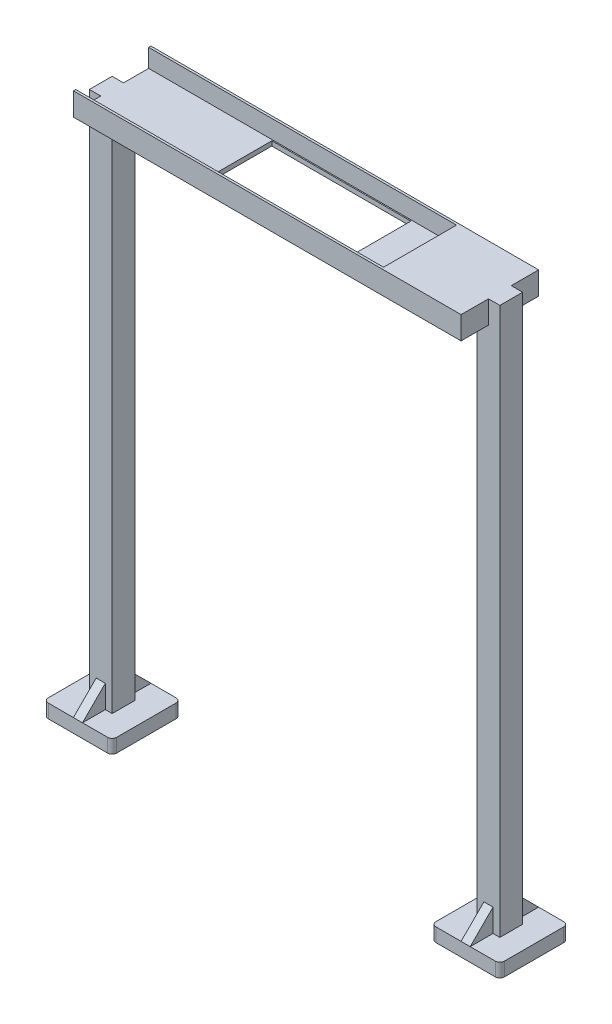
from build123d import *

# Parameters (mm, degrees)
SALIENTE_EXTRUIR1_DEPTH      = 3
SALIENTE_EXTRUIR1_2_DEPTH    = 3
SALIENTE_EXTRUIR2_DEPTH      = 1
SALIENTE_EXTRUIR2_DEPTH_BACK = 1
CROQUIS3_W                   = 5
CROQUIS3_H                   = 5
SALIENTE_EXTRUIR3_DEPTH      = 120
SALIENTE_EXTRUIR4_DEPTH      = 1
SALIENTE_EXTRUIR4_DEPTH_BACK = 1
CROQUIS7_W                   = 5
CROQUIS7_H                   = 5
SALIENTE_EXTRUIR6_DEPTH      = 120
CROQUIS8_W                   = 85
CROQUIS8_H                   = 17
SALIENTE_EXTRUIR7_DEPTH      = 5
CROQUIS9_W                   = 16
CROQUIS9_H                   = 4
CORTAR_EXTRUIR1_DEPTH        = 70
CROQUIS10_W                  = 30.5
CROQUIS10_H                  = 15.5
CORTAR_EXTRUIR2_DEPTH        = 2


with BuildPart() as part:
    # Croquis1 → Saliente-Extruir1 (new body)
    with BuildSketch(Plane(origin=(0, 0, 0), x_dir=(1, 0, 0), z_dir=(0, 1, 0))):
        with BuildLine():
            Line((-6.5, -7.5), (6.5, -7.5))
            ThreePointArc((6.5, -7.5), (7.207106781, -7.207106781), (7.5, -6.5))
            Line((7.5, -6.5), (7.5, 6.5))
            ThreePointArc((7.5, 6.5), (7.207106781, 7.207106781), (6.5, 7.5))
            Line((6.5, 7.5), (-6.5, 7.5))
            ThreePointArc((-6.5, 7.5), (-7.207106781, 7.207106781), (-7.5, 6.5))
            Line((-7.5, 6.5), (-7.5, -6.5))
            ThreePointArc((-7.5, -6.5), (-7.207106781, -7.207106781), (-6.5, -7.5))
        make_face()
    extrude(amount=SALIENTE_EXTRUIR1_DEPTH)

    # Croquis2 → Saliente-Extruir2 (add, two sides: drawn at the far end of the back side and taken through both)
    with BuildSketch(Plane(origin=(0, 0, 0), x_dir=(0, 0, -1), z_dir=(1, 0, 0)).offset(-SALIENTE_EXTRUIR2_DEPTH_BACK)):
        Polygon((-7.5, 3), (-2.5, 8), (-2.5, 3), align=None)
        Polygon((2.5, 3), (7.5, 3), (2.5, 8), align=None)
    extrude(amount=SALIENTE_EXTRUIR2_DEPTH + SALIENTE_EXTRUIR2_DEPTH_BACK)

    # Croquis3 → Saliente-Extruir3 (add)
    with BuildSketch(Plane(origin=(0, 3, 0), x_dir=(1, 0, 0), z_dir=(0, 1, 0))):
        Rectangle(CROQUIS3_W, CROQUIS3_H)
    extrude(amount=SALIENTE_EXTRUIR3_DEPTH)



with BuildPart() as body_2:
    # Croquis1 → Saliente-Extruir1 2 (new body)
    with BuildSketch(Plane(origin=(0, 0, 0), x_dir=(1, 0, 0), z_dir=(0, 1, 0))):
        with BuildLine():
            Line((77.5, -6.5), (77.5, 6.5))
            ThreePointArc((77.5, 6.5), (77.792893219, 7.207106781), (78.5, 7.5))
            Line((78.5, 7.5), (91.5, 7.5))
            ThreePointArc((91.5, 7.5), (92.207106781, 7.207106781), (92.5, 6.5))
            Line((92.5, 6.5), (92.5, -6.5))
            ThreePointArc((92.5, -6.5), (92.207106781, -7.207106781), (91.5, -7.5))
            Line((91.5, -7.5), (78.5, -7.5))
            ThreePointArc((78.5, -7.5), (77.792893219, -7.207106781), (77.5, -6.5))
        make_face()
    extrude(amount=SALIENTE_EXTRUIR1_2_DEPTH)

    # Croquis5 → Saliente-Extruir4 (add, two sides: drawn at the far end of the back side and taken through both)
    with BuildSketch(Plane(origin=(85, 0, 0), x_dir=(0, 0, -1), z_dir=(1, 0, 0)).offset(-SALIENTE_EXTRUIR4_DEPTH_BACK)):
        Polygon((-7.5, 3), (-2.5, 8), (-2.5, 3), align=None)
        Polygon((2.5, 8), (2.5, 3), (7.5, 3), align=None)
    extrude(amount=SALIENTE_EXTRUIR4_DEPTH + SALIENTE_EXTRUIR4_DEPTH_BACK)

    # Croquis7 → Saliente-Extruir6 (add)
    with BuildSketch(Plane(origin=(0, 3, 0), x_dir=(1, 0, 0), z_dir=(0, 1, 0))):
        with Locations((85, 0)):
            Rectangle(CROQUIS7_W, CROQUIS7_H)
    extrude(amount=SALIENTE_EXTRUIR6_DEPTH)


with BuildPart() as part_1:
    add(part.part)

    add(body_2.part)  # Saliente-Extruir7 merges body 2
    # Croquis8 → Saliente-Extruir7 (add)
    with BuildSketch(Plane(origin=(0, 118, 0), x_dir=(1, 0, 0), z_dir=(0, 1, 0))):
        with Locations((42.5, 0)):
            Rectangle(CROQUIS8_W, CROQUIS8_H)
    extrude(amount=SALIENTE_EXTRUIR7_DEPTH)

    # Croquis9 → Cortar-Extruir1 (cut)
    with BuildSketch(Plane.ZY.offset(2.5)):
        with Locations((0, 121)):
            Rectangle(CROQUIS9_W, CROQUIS9_H)
    extrude(amount=-CORTAR_EXTRUIR1_DEPTH, mode=Mode.SUBTRACT)

    # Croquis10 → Cortar-Extruir2 (cut)
    with BuildSketch(Plane.XZ.offset(-118)):
        with Locations((42.5, 0)):
            Rectangle(CROQUIS10_W, CROQUIS10_H)
    extrude(amount=-CORTAR_EXTRUIR2_DEPTH, mode=Mode.SUBTRACT)


solid = part_1.part
